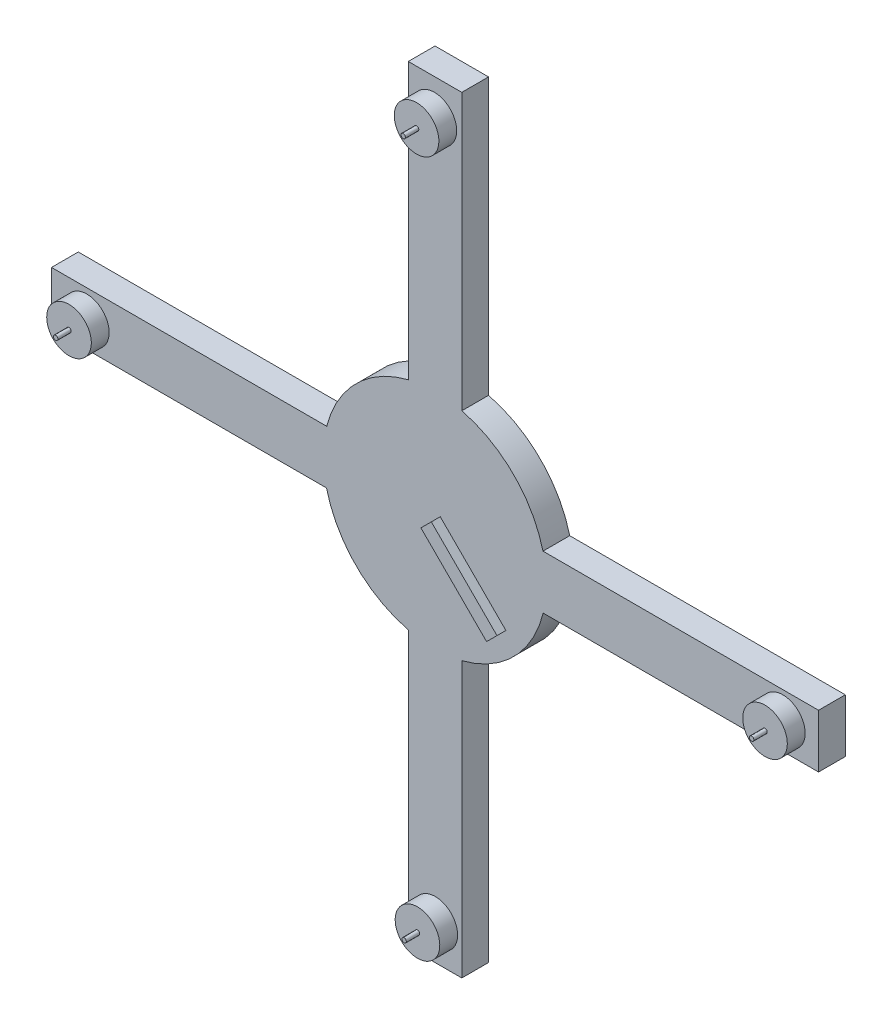
from build123d import *

# Parameters (mm, degrees)
BOSS_EXTRUDE1_DEPTH      = 15
BOSS_EXTRUDE1_DEPTH_BACK = 15
SKETCH2_R                = 25
BOSS_EXTRUDE2_DEPTH      = 20
SKETCH3_R                = 2.5
BOSS_EXTRUDE3_DEPTH      = 15
CIRPATTERN1_COUNT        = 4
BOSS_EXTRUDE4_DEPTH      = 10


with BuildPart() as part:
    # Sketch1 → Boss-Extrude1 (new, two sides: drawn at the far end of the back side and taken through both)
    with BuildSketch(Plane.XY.offset(-BOSS_EXTRUDE1_DEPTH_BACK)):
        with BuildLine():
            Line((30, 430), (-30, 430))
            Line((-30, 430), (-30, 120.881719036))
            ThreePointArc((-30, 120.881719036), (-88.332125518, 88.135628612), (-121.425810587, 30))
            Line((-121.425810587, 30), (-430, 30))
            Line((-430, 30), (-430, -30))
            Line((-430, -30), (-121.68100765, -30))
            ThreePointArc((-121.68100765, -30), (-88.7083861, -88.792246397), (-30, -121.91395242))
            Line((-30, -121.91395242), (-30, -430))
            Line((-30, -430), (30, -430))
            Line((30, -430), (30, -121.811124765))
            ThreePointArc((30, -121.811124765), (88.443617434, -88.640445466), (121.26508205, -30))
            Line((121.26508205, -30), (430, -30))
            Line((430, -30), (430, 30))
            Line((430, 30), (121.009884987, 30))
            ThreePointArc((121.009884987, 30), (88.068001132, 87.984471961), (30, 120.778891382))
            Line((30, 120.778891382), (30, 430))
        make_face()
    extrude(amount=BOSS_EXTRUDE1_DEPTH + BOSS_EXTRUDE1_DEPTH_BACK)

    # Sketch2 → Boss-Extrude2 (add)
    with BuildSketch(Plane.XY.offset(15)):
        with Locations((390, 0)):
            Circle(SKETCH2_R)
    boss_extrude2 = extrude(amount=BOSS_EXTRUDE2_DEPTH)

    # Sketch3 → Boss-Extrude3 (add)
    with BuildSketch(Plane.XY.offset(35)):
        with Locations((390, 0)):
            Circle(SKETCH3_R)
    boss_extrude3 = extrude(amount=BOSS_EXTRUDE3_DEPTH)

    # CirPattern1: Boss-Extrude2, Boss-Extrude3 ×4 about axis
    cirpattern1_axis = Axis((-0.2079628, -0.516116692, -15), (0, 0, 1))
    add([boss_extrude2.rotate(cirpattern1_axis, i * 360 / CIRPATTERN1_COUNT) for i in range(1, CIRPATTERN1_COUNT)])
    add([boss_extrude3.rotate(cirpattern1_axis, i * 360 / CIRPATTERN1_COUNT) for i in range(1, CIRPATTERN1_COUNT)])

    # Sketch4 → Boss-Extrude4 (add)
    with BuildSketch(Plane.XY.offset(15)):
        Polygon((-5.834664758, -5.834664758), (67.788123176, -79.457452693), (79.457452693, -67.788123176), (5.834664758, 5.834664758), align=None)
    extrude(amount=BOSS_EXTRUDE4_DEPTH)


solid = part.part
